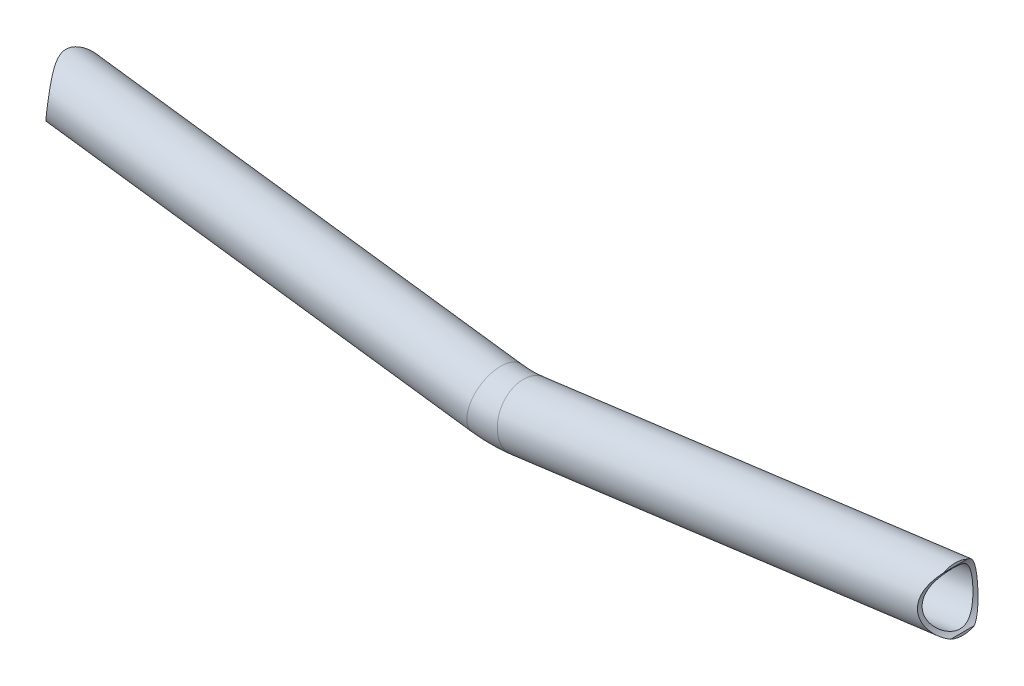
from build123d import *

# Parameters (mm, degrees)
ESBO_O2_R             = 12.75
ESBO_O2_R_2           = 10.75
ESBO_O3_R             = 16
CORTE_EXTRUS_O1_DEPTH = 35


with BuildPart() as part:
    # Varredura1: sweep along a path in Esboço1
    with BuildLine(Plane.XY) as varredura1_path:
        Line((-193.129443739, 25.425973626), (-6.526309611, 0.85920496))
        ThreePointArc((-6.526309611, 0.85920496), (0, 0.431448029), (6.526309611, 0.85920496))
        Line((6.526309611, 0.85920496), (191.870520585, 25.260233248))
    # Esboço2 → Varredura1 (sweep)
    with BuildSketch(Plane(origin=(191.870520585, 25.260233248, 0), x_dir=(0, 0, -1), z_dir=(0.9914448613738109, 0.13052619222004852, 0))):
        Circle(ESBO_O2_R)
        Circle(ESBO_O2_R_2, mode=Mode.SUBTRACT)
    sweep(path=varredura1_path.line)

    # Esboço3 → Corte-extrusão1 (cut, symmetric)
    with BuildSketch(Plane.XY):
        with Locations((-202.713054604, 26.687679932)):
            Circle(ESBO_O3_R)
    corte_extrus_o1 = extrude(amount=CORTE_EXTRUS_O1_DEPTH, both=True, mode=Mode.SUBTRACT)

    # Espelhar1: Corte-extrusão1 across plane
    add(corte_extrus_o1.mirror(Plane(origin=(0, 0, 0), x_dir=(0, 0, 1), z_dir=(1, 0, 0))), mode=Mode.SUBTRACT)


solid = part.part
